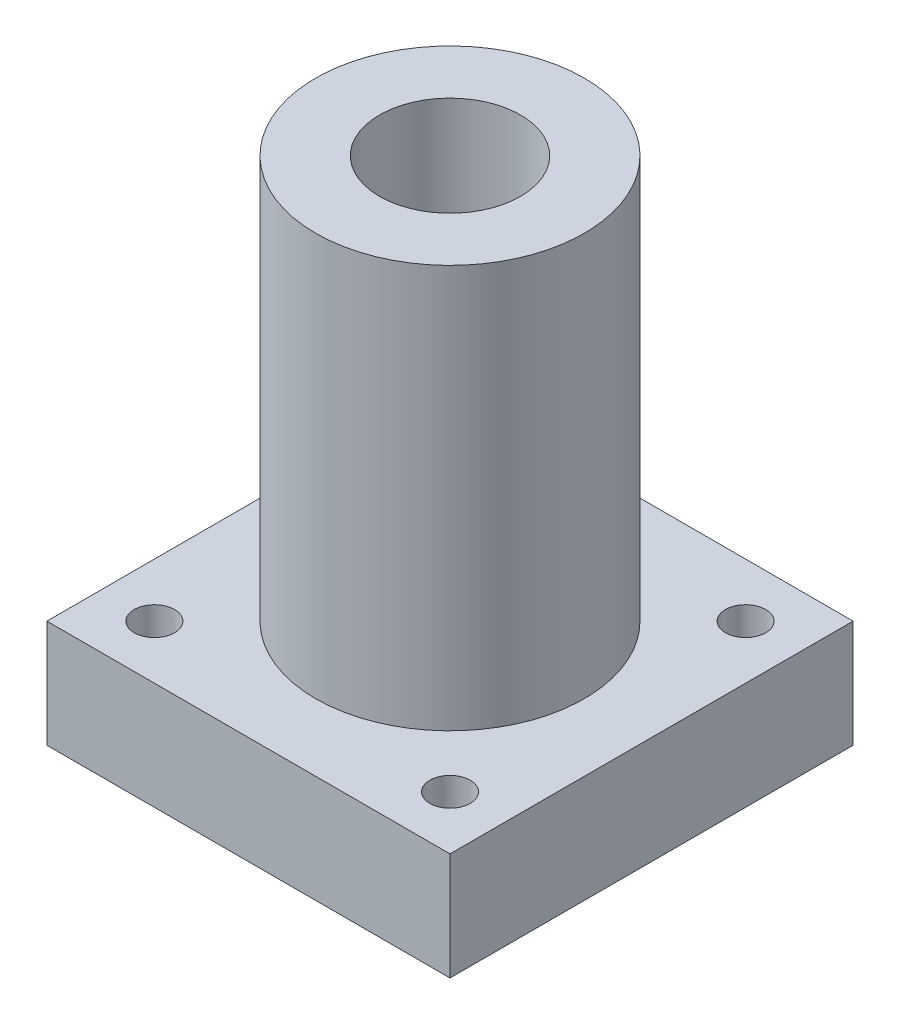
from build123d import *

# Parameters (mm, degrees)
IZIM1_W                     = 30
IZIM1_H                     = 30
Y_KSEKLIK_EKSTR_ZYON1_DEPTH = 40
IZIM2_R                     = 1.5
KES_EKSTR_ZYON1_DEPTH       = 40
IZIM3_R                     = 10
IZIM3_R_2                   = 5.25
Y_KSEKLIK_EKSTR_ZYON2_DEPTH = 40
IZIM4_W                     = 30
IZIM4_H                     = 30
KES_EKSTR_ZYON2_DEPTH       = 32
KES_EKSTR_ZYON3_START       = -10
IZIM5_R                     = 10
KES_EKSTR_ZYON3_DEPTH       = 10
KES_EKSTR_ZYON4_START       = -30
IZIM6_R                     = 5.25
KES_EKSTR_ZYON4_DEPTH       = 30


with BuildPart() as part:
    # Çizim1 → Yükseklik-Ekstrüzyon1 (new body)
    with BuildSketch(Plane(origin=(0, 0, 0), x_dir=(1, 0, 0), z_dir=(0, 1, 0))):
        with Locations((15, 15)):
            Rectangle(IZIM1_W, IZIM1_H)
    extrude(amount=Y_KSEKLIK_EKSTR_ZYON1_DEPTH)

    # Çizim2 → Kes-Ekstrüzyon1 (cut)
    with BuildSketch(Plane(origin=(0, 40, 0), x_dir=(1, 0, 0), z_dir=(0, 1, 0))):
        with Locations(Location((4, 26, 0), (0, 0, 270))):
            Circle(IZIM2_R)
        with Locations(Location((26, 26, 0), (0, 0, 270))):
            Circle(IZIM2_R)
        with Locations(Location((26, 4, 0), (0, 0, 270))):
            Circle(IZIM2_R)
        with Locations(Location((4, 4, 0), (0, 0, 270))):
            Circle(IZIM2_R)
    extrude(amount=-KES_EKSTR_ZYON1_DEPTH, mode=Mode.SUBTRACT)

    # Çizim3 → Yükseklik-Ekstrüzyon2 (add)
    with BuildSketch(Plane(origin=(0, 40, 0), x_dir=(1, 0, 0), z_dir=(0, 1, 0))):
        with Locations(Location((15, 15, 0), (0, 0, 90))):
            Circle(IZIM3_R)
        with Locations(Location((15, 15, 0), (0, 0, 270))):
            Circle(IZIM3_R_2, mode=Mode.SUBTRACT)
    extrude(amount=Y_KSEKLIK_EKSTR_ZYON2_DEPTH)

    # Çizim4 → Kes-Ekstrüzyon2 (cut)
    with BuildSketch(Plane.XZ):
        with Locations((15, -15)):
            Rectangle(IZIM4_W, IZIM4_H)
    extrude(amount=-KES_EKSTR_ZYON2_DEPTH, mode=Mode.SUBTRACT)

    # Çizim5 → Kes-Ekstrüzyon3 (cut)
    with BuildSketch(Plane(origin=(0, 80, 0), x_dir=(1, 0, 0), z_dir=(0, 1, 0)).offset(KES_EKSTR_ZYON3_START)):
        with Locations(Location((15, 15, 0), (0, 0, 90))):
            Circle(IZIM5_R)
    extrude(amount=KES_EKSTR_ZYON3_DEPTH, mode=Mode.SUBTRACT)

    # Çizim6 → Kes-Ekstrüzyon4 (cut)
    with BuildSketch(Plane(origin=(0, 40, 0), x_dir=(1, 0, 0), z_dir=(0, 1, 0)).offset(KES_EKSTR_ZYON4_START)):
        with Locations(Location((15, 15, 0), (0, 0, 270))):
            Circle(IZIM6_R)
    extrude(amount=KES_EKSTR_ZYON4_DEPTH, mode=Mode.SUBTRACT)


solid = part.part
